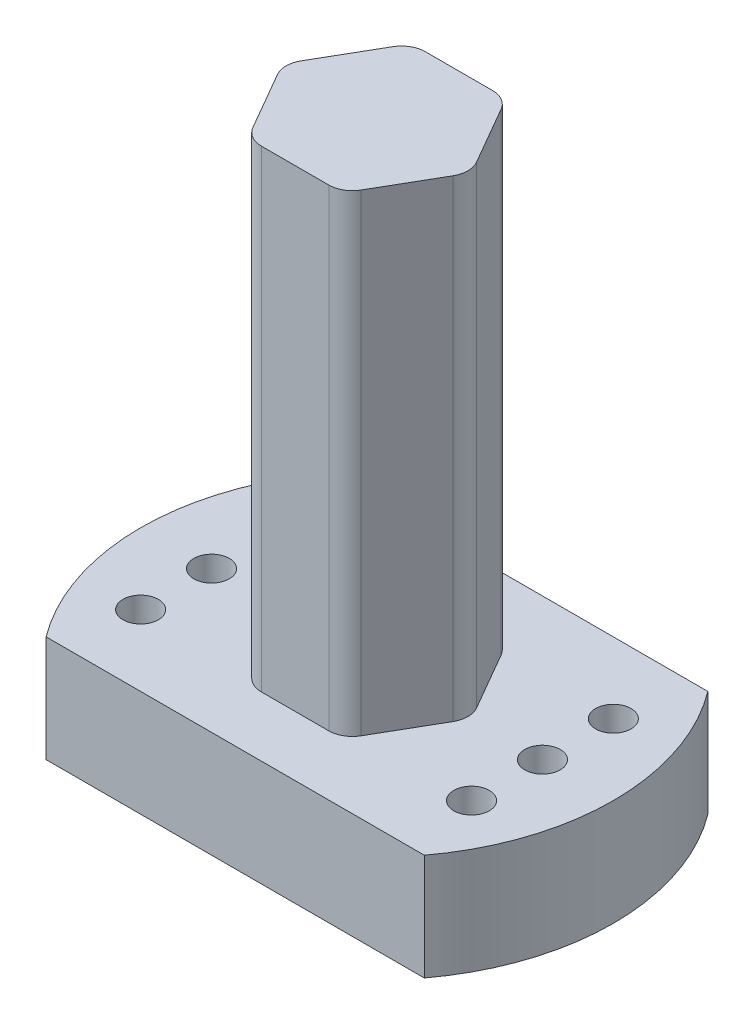
from build123d import *

# Parameters (mm, degrees)
SKETCH_1_R      = 0.75
EXTRUDE_1_DEPTH = 4.5
EXTRUDE_2_DEPTH = 20
FILLET_1_R      = 1


with BuildPart() as part:
    # Эскиз1 → Бобышка-Вытянуть1 (new body)
    with BuildSketch(Plane(origin=(0, 0, 0), x_dir=(1, 0, 0), z_dir=(0, 1, 0))):
        with BuildLine():
            Line((-8, 6), (8, 6))
            ThreePointArc((8, 6), (10, 0), (8, -6))
            Line((8, -6), (-8, -6))
            ThreePointArc((-8, -6), (-10, 0), (-8, 6))
        make_face()
        with Locations(Location((-7, 3, 0), (0, 0, 270))):
            Circle(SKETCH_1_R, mode=Mode.SUBTRACT)
        with Locations(Location((-7, 0, 0), (0, 0, 270))):
            Circle(SKETCH_1_R, mode=Mode.SUBTRACT)
        with Locations(Location((-7, -3, 0), (0, 0, 270))):
            Circle(SKETCH_1_R, mode=Mode.SUBTRACT)
        with Locations(Location((7, -3, 0), (0, 0, 90))):
            Circle(SKETCH_1_R, mode=Mode.SUBTRACT)
        with Locations(Location((7, 0, 0), (0, 0, 90))):
            Circle(SKETCH_1_R, mode=Mode.SUBTRACT)
        with Locations(Location((7, 3, 0), (0, 0, 90))):
            Circle(SKETCH_1_R, mode=Mode.SUBTRACT)
    extrude(amount=EXTRUDE_1_DEPTH)

    # Эскиз2 → Бобышка-Вытянуть2 (add)
    with BuildSketch(Plane(origin=(0, 4.5, 0), x_dir=(1, 0, 0), z_dir=(0, 1, 0))):
        Polygon((2, 3.464101615), (-2, 3.464101615), (-4, 0), (-2, -3.464101615), (2, -3.464101615), (4, 0), align=None)
    extrude(amount=EXTRUDE_2_DEPTH)

    # Скругление1
    fillet_1_edges = [part.edges().sort_by_distance(p)[0] for p in [
        (4, 14.5, 0),
        (2, 14.5, -3.464101615),
        (-2, 14.5, -3.464101615),
        (-4, 14.5, 0),
        (-2, 14.5, 3.464101615),
        (2, 14.5, 3.464101615),
    ]]
    fillet(fillet_1_edges, radius=FILLET_1_R)


solid = part.part
